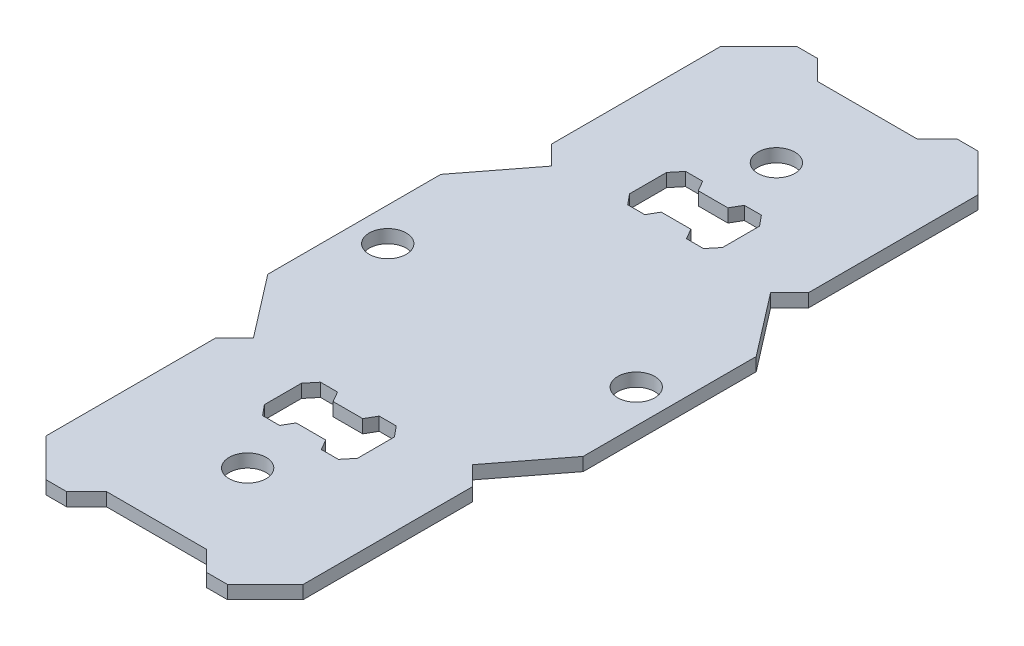
from build123d import *

# Parameters (mm, degrees)
SKETCH3_R           = 3.5
BOSS_EXTRUDE1_DEPTH = 2.5


with BuildPart() as part:
    # Sketch3 → Boss-Extrude1 (new body)
    with BuildSketch(Plane(origin=(0, 0, 0), x_dir=(1, 0, 0), z_dir=(0, 1, 0))):
        Polygon((-9.459826986, 67.208739943), (9.459826986, 67.208739943), (13.231926916, 70.980839873), (17.154910843, 70.980839873), (24.321900711, 63.813850005), (24.321900711, 31.751000599), (20.738405777, 28.167505665), (29.829166609, 16.360832883), (29.829166609, -16.360832883), (20.738405777, -28.167505665), (24.321900711, -31.751000599), (24.321900711, -63.813850005), (17.154910843, -70.980839873), (13.231926916, -70.980839873), (9.459826986, -67.208739943), (-9.459826986, -67.208739943), (-13.231926916, -70.980839873), (-17.154910843, -70.980839873), (-24.321900711, -63.813850005), (-24.321900711, -31.751000599), (-20.738405777, -28.167505665), (-29.829166609, -16.360832883), (-29.829166609, 16.360832883), (-20.738405777, 28.167505665), (-24.321900711, 31.751000599), (-24.321900711, 63.813850005), (-17.154910843, 70.980839873), (-13.231926916, 70.980839873), align=None)
        with Locations(Location((23.5, 0, 0), (0, 0, 270))):
            Circle(SKETCH3_R, mode=Mode.SUBTRACT)
        with Locations(Location((-23.5, 0, 0), (0, 0, 90))):
            Circle(SKETCH3_R, mode=Mode.SUBTRACT)
        with Locations(Location((0, 50, 0), (0, 0, 270))):
            Circle(SKETCH3_R, mode=Mode.SUBTRACT)
        with Locations(Location((0, -50, 0), (0, 0, 90))):
            Circle(SKETCH3_R, mode=Mode.SUBTRACT)
        Polygon((-2.79989697, 38.028097822), (2.79989697, 38.028097822), (3.941780629, 40.002717551), (7.169853306, 40.002717551), (8.795336711, 38.028097822), (8.795336711, 31.028097822), (7.169853306, 29.053478092), (3.941780629, 29.053478092), (2.79989697, 31.028097822), (-2.79989697, 31.028097822), (-3.941780629, 29.053478092), (-7.169853306, 29.053478092), (-8.795336711, 31.028097822), (-8.795336711, 38.028097822), (-7.169853306, 40.002717551), (-3.941780629, 40.002717551), align=None, mode=Mode.SUBTRACT)
        Polygon((-2.79989697, -31.028097822), (-3.941780629, -29.053478092), (-7.169853306, -29.053478092), (-8.795336711, -31.028097822), (-8.795336711, -38.028097822), (-7.169853306, -40.002717551), (-3.941780629, -40.002717551), (-2.79989697, -38.028097822), (2.79989697, -38.028097822), (3.941780629, -40.002717551), (7.169853306, -40.002717551), (8.795336711, -38.028097822), (8.795336711, -31.028097822), (7.169853306, -29.053478092), (3.941780629, -29.053478092), (2.79989697, -31.028097822), align=None, mode=Mode.SUBTRACT)
    extrude(amount=BOSS_EXTRUDE1_DEPTH)


solid = part.part
